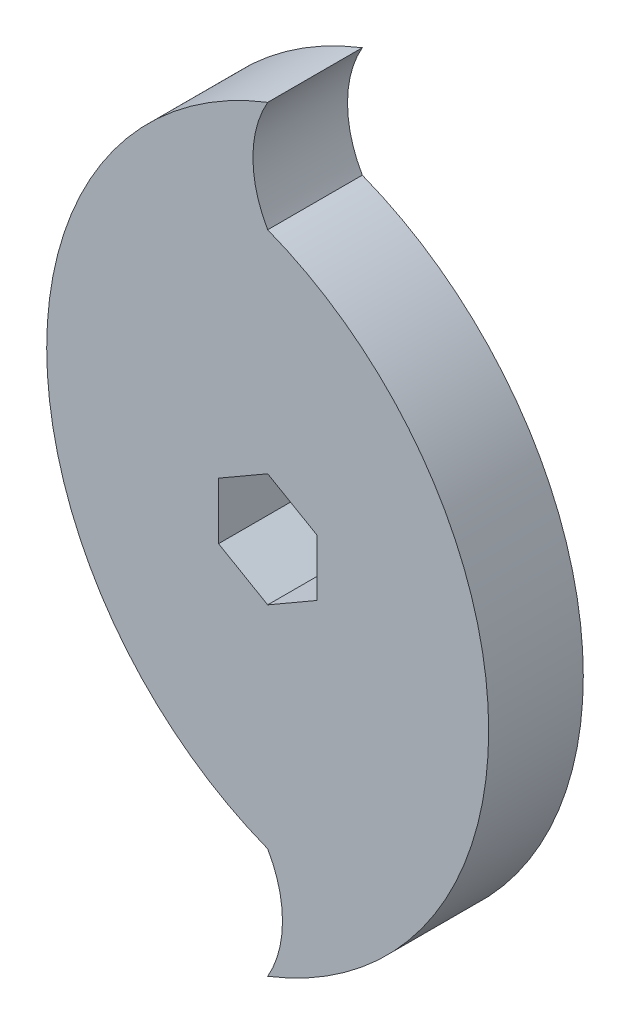
from build123d import *

# Parameters (mm, degrees)
BOSS_EXTRU_2_DEPTH      = 30
ENL_V_MAT_EXTRU_1_DEPTH = 252.815317877


with BuildPart() as part:
    # Esquisse1 → Boss.-Extru.2 (new body)
    with BuildSketch(Plane.XY):
        with BuildLine():
            ThreePointArc((0, -205), (-70.078201443, -102.5), (0, 0))
            ThreePointArc((0, 0), (-4.689110868, -17.5), (0, -35))
            ThreePointArc((0, -35), (70.078201443, -137.5), (0, -240))
            ThreePointArc((0, -240), (4.689110868, -222.5), (0, -205))
        make_face()
    extrude(amount=BOSS_EXTRU_2_DEPTH)

    # Esquisse2 → Enlèv. mat.-Extru.1 (cut, through all)
    with BuildSketch(Plane.XY.offset(30)):
        Polygon((15.588457268, -111), (0, -102), (-15.588457268, -111), (-15.588457268, -129), (0, -138), (15.588457268, -129), align=None)
    extrude(amount=-ENL_V_MAT_EXTRU_1_DEPTH, mode=Mode.SUBTRACT)


solid = part.part
